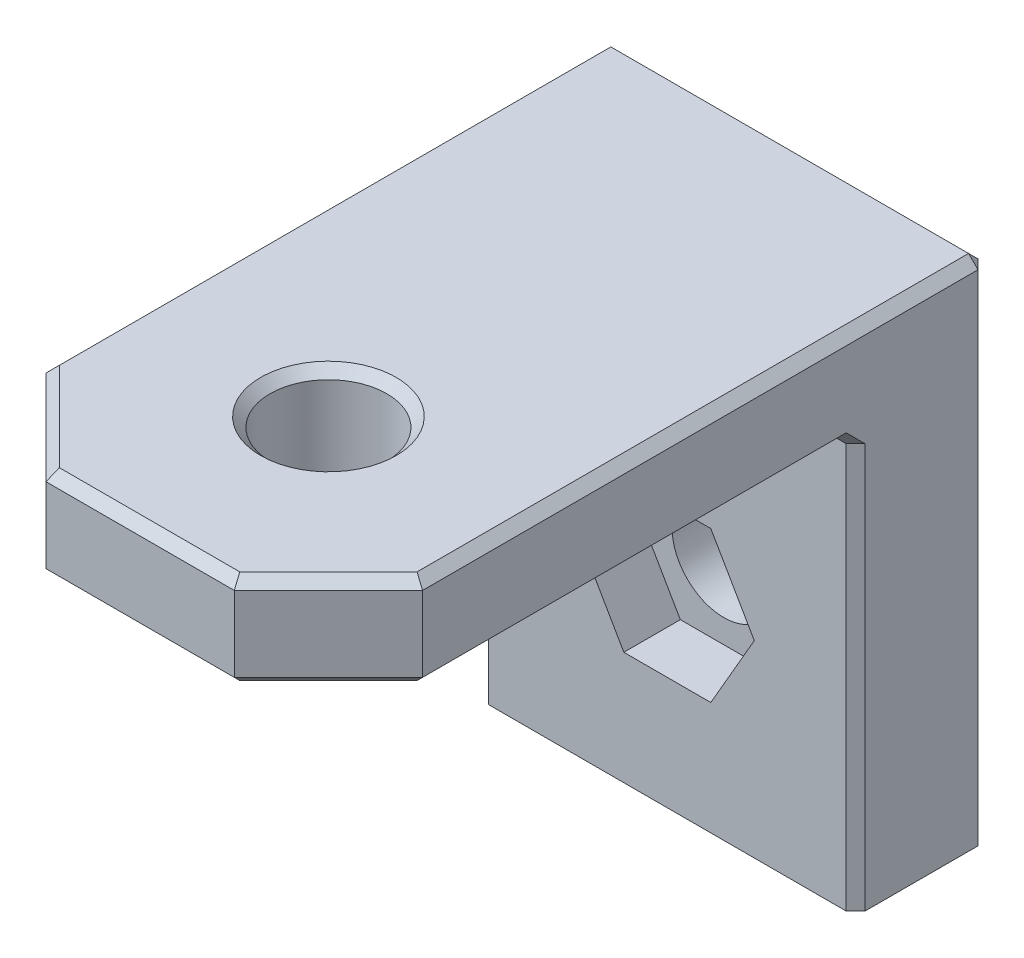
from build123d import *

# Parameters (mm, degrees)
SKETCH_1_W          = 20
SKETCH_1_H          = 28
EXTRUDE_1_DEPTH     = 5
SKETCH_1_3_W        = 20
SKETCH_1_3_H        = 7
EXTRUDE_2_DEPTH     = 27
SKETCH_2_R          = 5
EXTRUDE_3_DEPTH     = 2
SKETCH_5_R          = 2.75
CUT_EXTRUDE_2_DEPTH = 49.518037883
FILLET_1_R          = 1
SKETCH_6_R          = 3.1
CUT_EXTRUDE_3_DEPTH = 46
CUT_EXTRUDE_4_DEPTH = 3
CHAMFER_1_SIZE      = 5
CHAMFER_2_SIZE      = 0.5


with BuildPart() as part:
    # 草图1 → 凸台-拉伸1 (new body)
    with BuildSketch(Plane(origin=(0, 0, 0), x_dir=(1, 0, 0), z_dir=(0, 1, 0))):
        with Locations((10, 14)):
            Rectangle(SKETCH_1_W, SKETCH_1_H)
    extrude(amount=-EXTRUDE_1_DEPTH)

    # 草图1<3> → 凸台-拉伸2 (add)
    with BuildSketch(Plane(origin=(0, 0, 0), x_dir=(1, 0, 0), z_dir=(0, 1, 0))):
        with Locations((10, 31.5)):
            Rectangle(SKETCH_1_3_W, SKETCH_1_3_H)
    extrude(amount=-EXTRUDE_2_DEPTH)

    # 草图2 → 凸台-拉伸3 (add)
    with BuildSketch(Plane.XZ.offset(5)):
        with Locations(Location((10, -10, 0), (0, 0, 90))):
            Circle(SKETCH_2_R)
    extrude(amount=EXTRUDE_3_DEPTH)

    # 草图5 → 切除-拉伸2 (cut, through all)
    with BuildSketch(Plane(origin=(0, 0, -35), x_dir=(-1, 0, 0), z_dir=(0, 0, -1))):
        with Locations((-10, -17)):
            Circle(SKETCH_5_R)
    extrude(amount=-CUT_EXTRUDE_2_DEPTH, mode=Mode.SUBTRACT)

    # 圆角1
    fillet_1_edges = [part.edges().sort_by_distance(p)[0] for p in [
        (10, -5, -15),
    ]]
    fillet(fillet_1_edges, radius=FILLET_1_R)

    # 草图6 → 切除-拉伸3 (cut, through all)
    with BuildSketch(Plane.XZ.offset(7)):
        with Locations(Location((10, -10, 0), (0, 0, 270))):
            Circle(SKETCH_6_R)
    extrude(amount=-CUT_EXTRUDE_3_DEPTH, mode=Mode.SUBTRACT)

    # 草图7 → 切除-拉伸4 (cut)
    with BuildSketch(Plane.XY.offset(-28)):
        Polygon((14.618802154, -17), (12.309401077, -13), (7.690598923, -13), (5.381197846, -17), (7.690598923, -21), (12.309401077, -21), align=None)
    extrude(amount=-CUT_EXTRUDE_4_DEPTH, mode=Mode.SUBTRACT)

    # 倒角1
    chamfer_1_edges = [part.edges().sort_by_distance(p)[0] for p in [
        (0, -2.5, 0),
        (20, -2.5, 0),
    ]]
    chamfer(chamfer_1_edges, length=CHAMFER_1_SIZE)

    # 倒角2
    chamfer_2_edges = [part.edges().sort_by_distance(p)[0] for p in [
        (20, -16, -28),
        (0, -16, -28),
        (10, 0, -35),
        (10, -5, -28),
        (0, -13.5, -35),
        (20, -13.5, -35),
        (10, -27, -35),
        (12.75, -17, -35),
        (10, 0, -6.9),
        (10, 0, 0),
        (10, -5, 0),
        (20, 0, -20),
        (0, 0, -20),
        (2.5, 0, -2.5),
        (17.5, 0, -2.5),
        (20, -5, -16.5),
        (0, -5, -16.5),
        (2.5, -5, -2.5),
        (17.5, -5, -2.5),
    ]]
    chamfer(chamfer_2_edges, length=CHAMFER_2_SIZE)


solid = part.part
